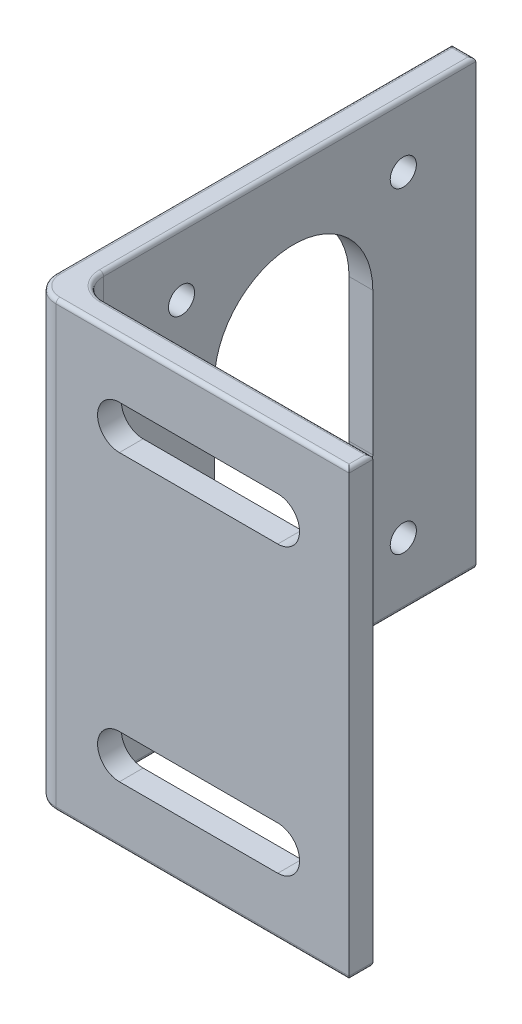
from build123d import *

# Parameters (mm, degrees)
EXTRUDE_1_DEPTH              = 56
FILLET_1_R                   = 3
FILLET_2_R                   = 0.5
CUT_EXTRUDE_1_REACH          = 82.045
CUT_EXTRUDE_2_REACH          = 76.297
HOLE_WIZARD_M4_1_D           = 3.3
HOLE_WIZARD_M4_1_CSINK_D     = 4.5
HOLE_WIZARD_M4_1_CSINK_ANGLE = 90


with BuildPart() as part:
    # 草图1 → 拉伸-薄壁1 (new body)
    with BuildSketch(Plane(origin=(0, 0, 0), x_dir=(1, 0, 0), z_dir=(0, 1, 0))):
        Polygon((-18.5, 25), (-18.5, -25), (18.5, -25), (18.5, -28), (-21.5, -28), (-21.5, 25), align=None)
    extrude(amount=EXTRUDE_1_DEPTH)

    # 圆角1
    fillet_1_edges = [part.edges().sort_by_distance(p)[0] for p in [
        (-21.5, 28, 28),
        (-18.5, 28, 25),
    ]]
    fillet(fillet_1_edges, radius=FILLET_1_R)

    # 圆角2
    fillet_2_edges = [part.edges().sort_by_distance(p)[0] for p in [
        (0, 0, 28),
        (18.5, 0, 26.5),
        (1.5, 0, 25),
        (-18.5, 0, -1.5),
        (-20, 0, -25),
        (-21.5, 0, 0),
        (18.5, 56, 26.5),
        (1.5, 56, 25),
        (-18.5, 56, -1.5),
        (-20, 56, -25),
        (-21.5, 56, 0),
        (0, 56, 28),
        (-20.621320344, 0, 27.121320344),
        (-20.621320344, 56, 27.121320344),
    ]]
    fillet(fillet_2_edges, radius=FILLET_2_R)

    # 草图2 → 切除-拉伸1 (cut, up to next)
    with BuildSketch(Plane.XY.offset(28), mode=Mode.PRIVATE) as cut_extrude_1_sk1:
        with BuildLine():
            Line((-10.5, 48.75), (9.5, 48.75))
            ThreePointArc((9.5, 48.75), (12.25, 46), (9.5, 43.25))
            Line((9.5, 43.25), (-10.5, 43.25))
            ThreePointArc((-10.5, 43.25), (-13.25, 46), (-10.5, 48.75))
        make_face()
    cut_extrude_1_tool1 = extrude(cut_extrude_1_sk1.sketch, amount=-CUT_EXTRUDE_1_REACH, mode=Mode.PRIVATE) & part.part
    # 草图2 → 切除-拉伸1 (cut, up to next)
    with BuildSketch(Plane.XY.offset(28), mode=Mode.PRIVATE) as cut_extrude_1_sk2:
        with BuildLine():
            Line((-10.5, 7.25), (9.5, 7.25))
            ThreePointArc((9.5, 7.25), (12.25, 10), (9.5, 12.75))
            Line((9.5, 12.75), (-10.5, 12.75))
            ThreePointArc((-10.5, 12.75), (-13.25, 10), (-10.5, 7.25))
        make_face()
    cut_extrude_1_tool2 = extrude(cut_extrude_1_sk2.sketch, amount=-CUT_EXTRUDE_1_REACH, mode=Mode.PRIVATE) & part.part
    add(cut_extrude_1_tool1.solids().sort_by_distance((-0.5, 46, 28))[0], mode=Mode.SUBTRACT)
    add(cut_extrude_1_tool2.solids().sort_by_distance((-0.5, 10, 28))[0], mode=Mode.SUBTRACT)

    # 草图3 → 切除-拉伸2 (cut, up to next)
    with BuildSketch(Plane.ZY.offset(21.5), mode=Mode.PRIVATE) as cut_extrude_2_sk1:
        with BuildLine():
            Line((-12, 19), (-12, 37))
            ThreePointArc((-12, 37), (-2, 47), (8, 37))
            Line((8, 37), (8, 19))
            ThreePointArc((8, 19), (-2, 9), (-12, 19))
        make_face()
    cut_extrude_2_tool1 = extrude(cut_extrude_2_sk1.sketch, amount=-CUT_EXTRUDE_2_REACH, mode=Mode.PRIVATE) & part.part
    add(cut_extrude_2_tool1.solids().sort_by_distance((-21.5, 28, -2))[0], mode=Mode.SUBTRACT)

    # M4 螺纹孔1 (through all)
    with Locations(Plane(origin=(-21.5, 8, -15.849623113), x_dir=(0, 0, -1), z_dir=(-1, 0, 0))):
        with Locations((0, 0), (-14, -20), (0, -40), (-28, -40), (-28, 0)):
            CounterSinkHole(HOLE_WIZARD_M4_1_D / 2, HOLE_WIZARD_M4_1_CSINK_D / 2, counter_sink_angle=HOLE_WIZARD_M4_1_CSINK_ANGLE)


solid = part.part
